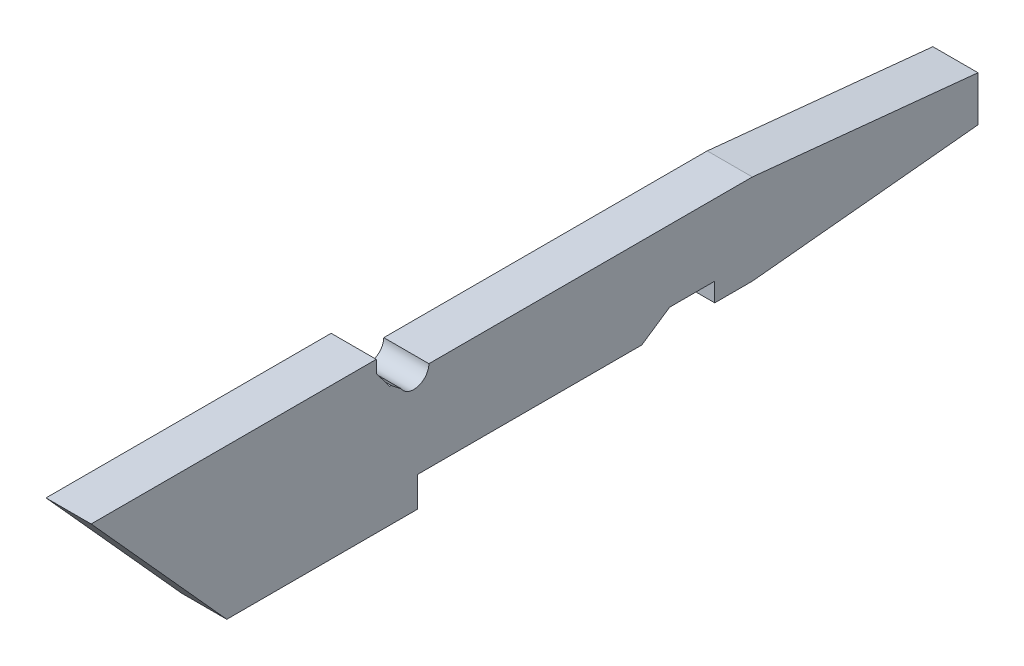
from build123d import *

# Parameters (mm, degrees)
EXTRUDE_1_DEPTH = 6


with BuildPart() as part:
    # 스케치1 → 보스-돌출1 (new, symmetric)
    with BuildSketch(Plane(origin=(0, 0, 0), x_dir=(0, 0, -1), z_dir=(1, 0, 0))):
        with BuildLine():
            Line((0, 6), (0, -6))
            Line((0, -6), (-60, -12))
            Line((-60, -12), (-70, -12))
            Line((-70, -12), (-70, -7))
            Line((-70, -7), (-82, -7))
            Line((-82, -7), (-89.403074012, -12))
            Line((-89.403074012, -12), (-149, -12))
            Line((-149, -12), (-149, -20))
            Line((-149, -20), (-199.739657381, -20))
            Line((-199.739657381, -20), (-235.816329231, 20))
            Line((-235.816329231, 20), (-160, 20))
            Line((-160, 20), (-160, 16.749981814))
            Line((-160, 16.749981814), (-156.437513639, 12))
            Line((-156.437513639, 12), (-156.019273901, 12))
            Line((-156.019273901, 12), (-153.375521927, 9.919487169))
            ThreePointArc((-153.375521927, 9.919487169), (-148.913971149, 8.215866364), (-146.000538153, 12))
            Line((-146.000538153, 12), (-60, 12))
            Line((-60, 12), (0, 6))
        make_face()
    extrude(amount=EXTRUDE_1_DEPTH, both=True)


solid = part.part
